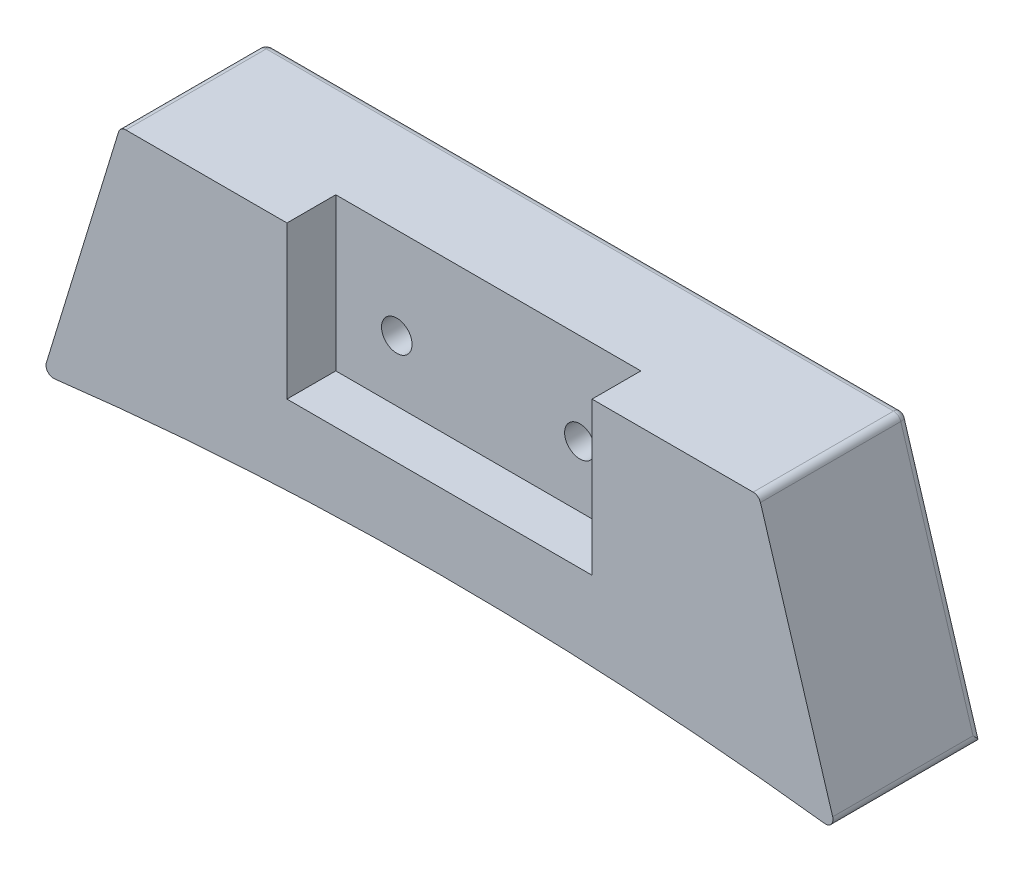
from build123d import *

# Parameters (mm, degrees)
EXTRUDE_1_DEPTH          = 9.7
CUT_EXTRUDE_2_DEPTH      = 32.520737269
FILLET_3_R               = 0.5
CUT_EXTRUDE_5_DEPTH      = 32.353102755
CUT_EXTRUDE_5_DEPTH_BACK = 3.2
SKETCH_18_R              = 1
CUT_EXTRUDE_6_DEPTH      = 31.515193795


with BuildPart() as part:
    # 草图1 → 凸台-拉伸1 (new body)
    with BuildSketch(Plane.XY):
        with BuildLine():
            Line((-21, 14.94880858), (21, 14.94880858))
            Line((21, 14.94880858), (23.5, 14.94880858))
            Line((23.5, 14.94880858), (26, -1.615739558))
            ThreePointArc((26, -1.615739558), (0, 0), (-26, -1.615739558))
            Line((-26, -1.615739558), (-23.5, 14.94880858))
            Line((-23.5, 14.94880858), (-21, 14.94880858))
        make_face()
    extrude(amount=EXTRUDE_1_DEPTH)

    # 草图10 → 切除-拉伸2 (cut, through all)
    with BuildSketch(Plane.XY.offset(9.7)):
        Polygon((26, -1.615739558), (20.914837438, 15.00313582), (23.5, 14.94880858), align=None)
    cut_extrude_2 = extrude(amount=-CUT_EXTRUDE_2_DEPTH, mode=Mode.SUBTRACT)

    # 镜向1: 切除-拉伸2 across plane
    add(cut_extrude_2.mirror(Plane(origin=(0, 0, 0), x_dir=(0, 0, 1), z_dir=(1, 0, 0))), mode=Mode.SUBTRACT)

    # 圆角3
    fillet_3_edges = [part.edges().sort_by_distance(p)[0] for p in [
        (26, -1.615739558, 4.85),
        (-26, -1.615739558, 4.85),
        (0, 14.94880858, 0),
        (23.465730438, 6.666534511, 0),
        (20.931460876, 14.94880858, 4.85),
        (-23.465730438, 6.666534511, 0),
        (-20.931460876, 14.94880858, 4.85),
    ]]
    fillet(fillet_3_edges, radius=FILLET_3_R)

    # 草图17 → 切除-拉伸5 (cut, two sides: drawn at the far end of the back side and taken through both)
    with BuildSketch(Plane.XY.offset(9.7).offset(-CUT_EXTRUDE_5_DEPTH_BACK)):
        Polygon((-10, 103.759816228), (-10, 14.94880858), (-10, 4.94880858), (10, 4.94880858), (10, 14.94880858), (10, 103.759816228), (10, 281.381831522), (-10, 281.381831522), align=None)
    extrude(amount=CUT_EXTRUDE_5_DEPTH + CUT_EXTRUDE_5_DEPTH_BACK, mode=Mode.SUBTRACT)

    # 草图18 → 切除-拉伸6 (cut, through all)
    with BuildSketch(Plane.XY.offset(6.5)):
        with Locations((-6, 8.94880858)):
            Circle(SKETCH_18_R)
        with Locations((6, 8.94880858)):
            Circle(SKETCH_18_R)
    extrude(amount=-CUT_EXTRUDE_6_DEPTH, mode=Mode.SUBTRACT)


solid = part.part
